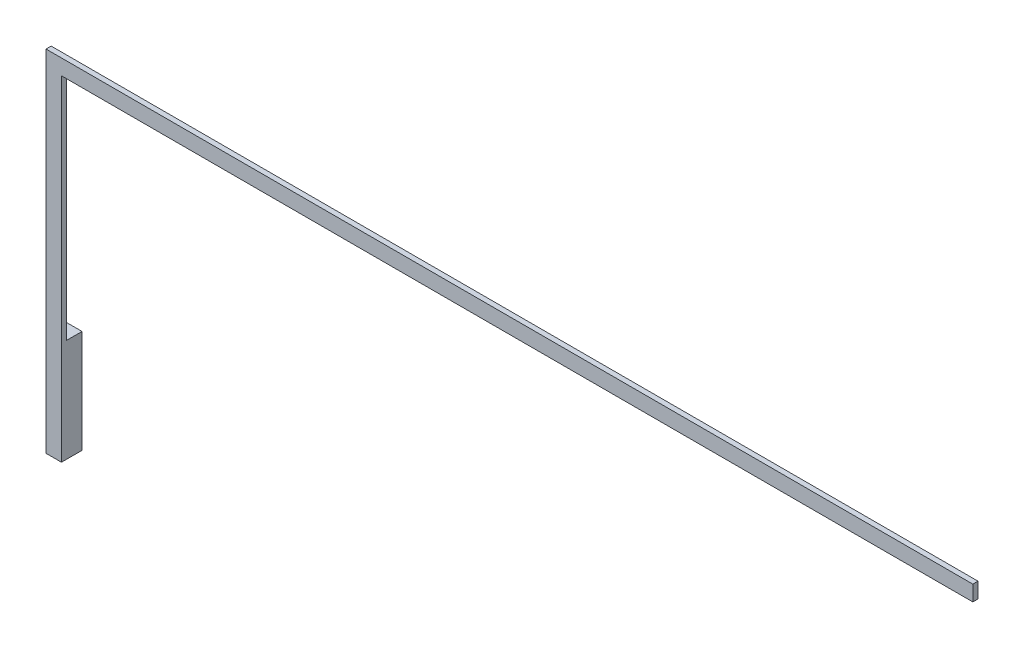
from build123d import *

# Parameters (mm, degrees)
BOSS_EXTRUDE1_DEPTH = 5
SKETCH3_W           = 15
SKETCH3_H           = 100
BOSS_EXTRUDE2_DEPTH = 15


with BuildPart() as part:
    # Sketch1 → Boss-Extrude1 (new body)
    with BuildSketch(Plane.XY):
        Polygon((0, 0), (0, -340), (15, -340), (15, -14.996834209), (900, -14.996834209), (900, 0), align=None)
    extrude(amount=BOSS_EXTRUDE1_DEPTH)

    # Sketch3 → Boss-Extrude2 (add)
    with BuildSketch(Plane.XY):
        with Locations((7.5, -290)):
            Rectangle(SKETCH3_W, SKETCH3_H)
    extrude(amount=-BOSS_EXTRUDE2_DEPTH)


solid = part.part
